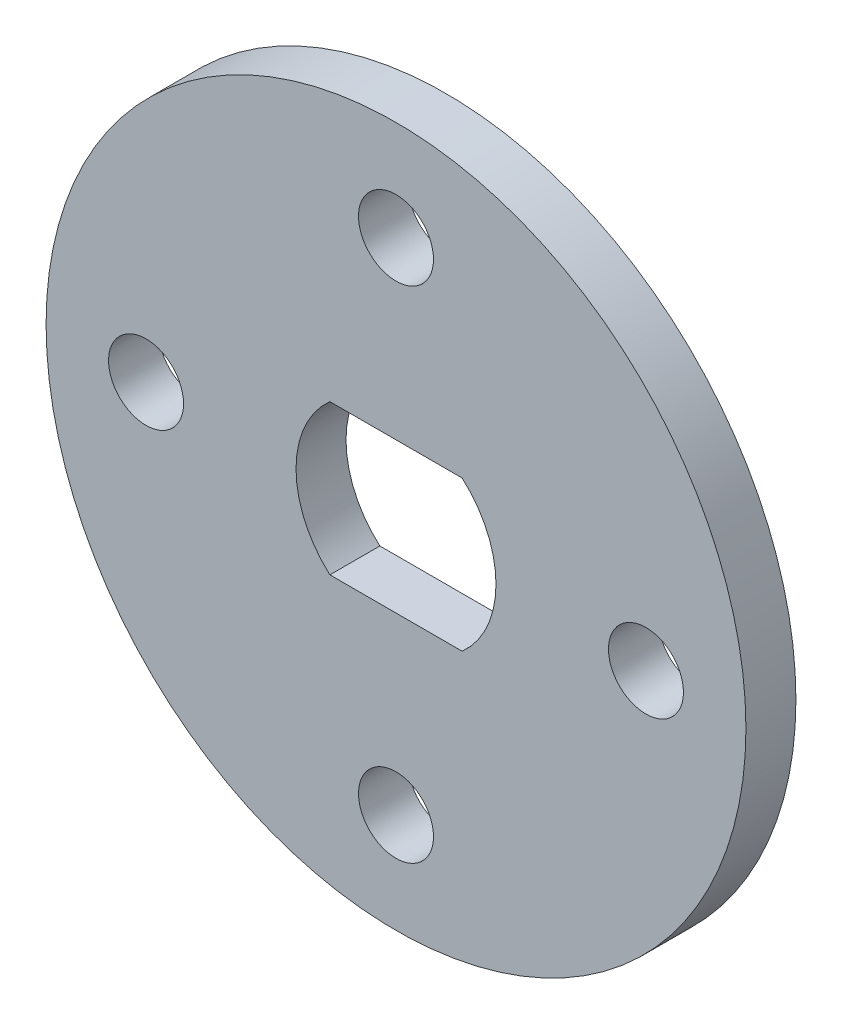
from build123d import *

# Parameters (mm, degrees)
SKETCH_1_R          = 14
SKETCH_1_R_2        = 1.5
EXTRUDE_1_DEPTH     = 2
CUT_EXTRUDE_1_DEPTH = 20.899748742


with BuildPart() as part:
    # 草图1 → 凸台-拉伸1 (new body)
    with BuildSketch(Plane.XY):
        Circle(SKETCH_1_R)
        with Locations((0, 10)):
            Circle(SKETCH_1_R_2, mode=Mode.SUBTRACT)
        with Locations((10, 0)):
            Circle(SKETCH_1_R_2, mode=Mode.SUBTRACT)
        with Locations((-10, 0)):
            Circle(SKETCH_1_R_2, mode=Mode.SUBTRACT)
        with Locations((0, -10)):
            Circle(SKETCH_1_R_2, mode=Mode.SUBTRACT)
    extrude(amount=EXTRUDE_1_DEPTH)

    # 草图2 → 切除-拉伸1 (cut, through all)
    with BuildSketch(Plane(origin=(0, 0, 0), x_dir=(-1, 0, 0), z_dir=(0, 0, -1))):
        with BuildLine():
            ThreePointArc((-2.645751311, 3), (-4, 0), (-2.645751311, -3))
            Line((-2.645751311, -3), (2.645751311, -3))
            ThreePointArc((2.645751311, -3), (4, 0), (2.645751311, 3))
            Line((2.645751311, 3), (-2.645751311, 3))
        make_face()
    extrude(amount=-CUT_EXTRUDE_1_DEPTH, mode=Mode.SUBTRACT)


solid = part.part
